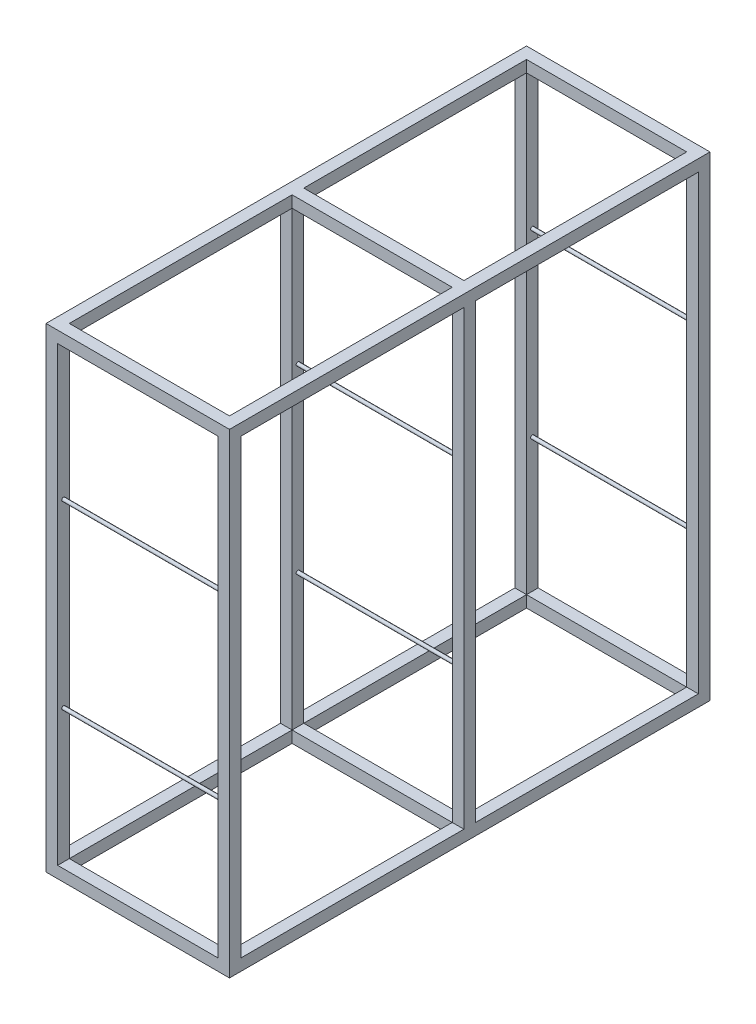
from build123d import *

# Parameters (mm, degrees)
SKETCH1_W             = 40
SKETCH1_H             = 40
SKETCH1_W_2           = 36
SKETCH1_H_2           = 36
BOSS_EXTRUDE1_DEPTH   = 825
BOSS_EXTRUDE1_2_DEPTH = 825
SKETCH2_W             = 40
SKETCH2_H             = 40
SKETCH2_W_2           = 36
SKETCH2_H_2           = 36
BOSS_EXTRUDE2_DEPTH   = 550
SKETCH3_W             = 40
SKETCH3_H             = 40
SKETCH3_W_2           = 36
SKETCH3_H_2           = 36
BOSS_EXTRUDE5_DEPTH   = 1551.5
SKETCH5_W             = 40
SKETCH5_H             = 40
SKETCH5_W_2           = 38
SKETCH5_H_2           = 38
BOSS_EXTRUDE6_DEPTH   = 1650
SKETCH6_W             = 40
SKETCH6_H             = 40
SKETCH6_W_2           = 38
SKETCH6_H_2           = 38
BOSS_EXTRUDE7_DEPTH   = 550
SKETCH7_R             = 6
BOSS_EXTRUDE8_DEPTH   = 550
SKETCH8_W             = 40
SKETCH8_H             = 40
BOSS_EXTRUDE10_DEPTH  = 1
SKETCH9_W             = 40
SKETCH9_H             = 40
BOSS_EXTRUDE11_DEPTH  = 1


with BuildPart() as part:
    # Sketch1 → Boss-Extrude1 (new, symmetric)
    with BuildSketch(Plane.XY):
        with Locations((-295, 20)):
            Rectangle(SKETCH1_W, SKETCH1_H)
        with Locations((-295, 20)):
            Rectangle(SKETCH1_W_2, SKETCH1_H_2, mode=Mode.SUBTRACT)
    extrude(amount=BOSS_EXTRUDE1_DEPTH, both=True)



with BuildPart() as body_2:
    # Sketch1 → Boss-Extrude1 2 (new, symmetric)
    with BuildSketch(Plane.XY):
        with Locations((295, 20)):
            Rectangle(SKETCH1_W, SKETCH1_H)
        with Locations((295, 20)):
            Rectangle(SKETCH1_W_2, SKETCH1_H_2, mode=Mode.SUBTRACT)
    extrude(amount=BOSS_EXTRUDE1_2_DEPTH, both=True)


with BuildPart() as part_1:
    add(part.part)

    add(body_2.part)  # Boss-Extrude2 merges body 2
    # Sketch2 → Boss-Extrude2 (add)
    # profile 1 of 3: a face of its own
    with BuildSketch(Plane(origin=(-275, 0, 0), x_dir=(0, 0, -1), z_dir=(1, 0, 0))):
        with Locations((-805, 20)):
            Rectangle(SKETCH2_W, SKETCH2_H)
        with Locations((-805, 20)):
            Rectangle(SKETCH2_W_2, SKETCH2_H_2, mode=Mode.SUBTRACT)
    # profile 2 of 3: a face of its own
    with BuildSketch(Plane(origin=(-275, 0, 0), x_dir=(0, 0, -1), z_dir=(1, 0, 0))):
        with Locations((805, 20)):
            Rectangle(SKETCH2_W, SKETCH2_H)
        with Locations((805, 20)):
            Rectangle(SKETCH2_W_2, SKETCH2_H_2, mode=Mode.SUBTRACT)
    # profile 3 of 3: a face of its own
    with BuildSketch(Plane(origin=(-275, 0, 0), x_dir=(0, 0, -1), z_dir=(1, 0, 0))):
        with Locations((0, 20)):
            Rectangle(SKETCH2_W, SKETCH2_H)
        with Locations((0, 20)):
            Rectangle(SKETCH2_W_2, SKETCH2_H_2, mode=Mode.SUBTRACT)
    extrude(amount=BOSS_EXTRUDE2_DEPTH)

    # Sketch3 → Boss-Extrude5 (add)
    # profile 1 of 6: a face of its own
    with BuildSketch(Plane(origin=(0, 40, 0), x_dir=(1, 0, 0), z_dir=(0, 1, 0))):
        with Locations((-295, -805)):
            Rectangle(SKETCH3_W, SKETCH3_H)
        with Locations((-295, -805)):
            Rectangle(SKETCH3_W_2, SKETCH3_H_2, mode=Mode.SUBTRACT)
    # profile 2 of 6: a face of its own
    with BuildSketch(Plane(origin=(0, 40, 0), x_dir=(1, 0, 0), z_dir=(0, 1, 0))):
        with Locations((295, -805)):
            Rectangle(SKETCH3_W, SKETCH3_H)
        with Locations((295, -805)):
            Rectangle(SKETCH3_W_2, SKETCH3_H_2, mode=Mode.SUBTRACT)
    # profile 3 of 6: a face of its own
    with BuildSketch(Plane(origin=(0, 40, 0), x_dir=(1, 0, 0), z_dir=(0, 1, 0))):
        with Locations((295, 0)):
            Rectangle(SKETCH3_W, SKETCH3_H)
        with Locations((295, 0)):
            Rectangle(SKETCH3_W_2, SKETCH3_H_2, mode=Mode.SUBTRACT)
    # profile 4 of 6: a face of its own
    with BuildSketch(Plane(origin=(0, 40, 0), x_dir=(1, 0, 0), z_dir=(0, 1, 0))):
        with Locations((-295, 0)):
            Rectangle(SKETCH3_W, SKETCH3_H)
        with Locations((-295, 0)):
            Rectangle(SKETCH3_W_2, SKETCH3_H_2, mode=Mode.SUBTRACT)
    # profile 5 of 6: a face of its own
    with BuildSketch(Plane(origin=(0, 40, 0), x_dir=(1, 0, 0), z_dir=(0, 1, 0))):
        with Locations((-295, 805)):
            Rectangle(SKETCH3_W, SKETCH3_H)
        with Locations((-295, 805)):
            Rectangle(SKETCH3_W_2, SKETCH3_H_2, mode=Mode.SUBTRACT)
    # profile 6 of 6: a face of its own
    with BuildSketch(Plane(origin=(0, 40, 0), x_dir=(1, 0, 0), z_dir=(0, 1, 0))):
        with Locations((295, 805)):
            Rectangle(SKETCH3_W, SKETCH3_H)
        with Locations((295, 805)):
            Rectangle(SKETCH3_W_2, SKETCH3_H_2, mode=Mode.SUBTRACT)
    extrude(amount=BOSS_EXTRUDE5_DEPTH)

    # Sketch5 → Boss-Extrude6 (add)
    # profile 1 of 2: a face of its own
    with BuildSketch(Plane.XY.offset(825)):
        with Locations((-295, 1611.5)):
            Rectangle(SKETCH5_W, SKETCH5_H)
        with Locations((-295, 1611.5)):
            Rectangle(SKETCH5_W_2, SKETCH5_H_2, mode=Mode.SUBTRACT)
    # profile 2 of 2: a face of its own
    with BuildSketch(Plane.XY.offset(825)):
        with Locations((295, 1611.5)):
            Rectangle(SKETCH5_W, SKETCH5_H)
        with Locations((295, 1611.5)):
            Rectangle(SKETCH5_W_2, SKETCH5_H_2, mode=Mode.SUBTRACT)
    extrude(amount=-BOSS_EXTRUDE6_DEPTH)

    # Sketch6 → Boss-Extrude7 (add)
    # profile 1 of 3: a face of its own
    with BuildSketch(Plane(origin=(-275, 0, 0), x_dir=(0, 0, -1), z_dir=(1, 0, 0))):
        with Locations((0, 1611.5)):
            Rectangle(SKETCH6_W, SKETCH6_H)
        with Locations((0, 1611.5)):
            Rectangle(SKETCH6_W_2, SKETCH6_H_2, mode=Mode.SUBTRACT)
    # profile 2 of 3: a face of its own
    with BuildSketch(Plane(origin=(-275, 0, 0), x_dir=(0, 0, -1), z_dir=(1, 0, 0))):
        with Locations((-805, 1611.5)):
            Rectangle(SKETCH6_W, SKETCH6_H)
        with Locations((-805, 1611.5)):
            Rectangle(SKETCH6_W_2, SKETCH6_H_2, mode=Mode.SUBTRACT)
    # profile 3 of 3: a face of its own
    with BuildSketch(Plane(origin=(-275, 0, 0), x_dir=(0, 0, -1), z_dir=(1, 0, 0))):
        with Locations((805, 1611.5)):
            Rectangle(SKETCH6_W, SKETCH6_H)
        with Locations((805, 1611.5)):
            Rectangle(SKETCH6_W_2, SKETCH6_H_2, mode=Mode.SUBTRACT)
    extrude(amount=BOSS_EXTRUDE7_DEPTH)

    # Sketch7 → Boss-Extrude8 (add)
    with BuildSketch(Plane.ZY.offset(-275)):
        with Locations(Location((805, 1119, 0), (0, 0, 180))):
            Circle(SKETCH7_R)
        with Locations(Location((805, 499, 0), (0, 0, 180))):
            Circle(SKETCH7_R)
        with Locations(Location((0, 1119, 0), (0, 0, 180))):
            Circle(SKETCH7_R)
        with Locations(Location((0, 499, 0), (0, 0, 180))):
            Circle(SKETCH7_R)
        with Locations(Location((-805, 499, 0), (0, 0, 180))):
            Circle(SKETCH7_R)
        with Locations(Location((-805, 1119, 0), (0, 0, 180))):
            Circle(SKETCH7_R)
    extrude(amount=BOSS_EXTRUDE8_DEPTH)

    # Sketch8 → Boss-Extrude10 (add)
    with BuildSketch(Plane.XY.offset(825)):
        with Locations((-295, 1611.5)):
            Rectangle(SKETCH8_W, SKETCH8_H)
        with Locations((295, 1611.5)):
            Rectangle(SKETCH8_W, SKETCH8_H)
        with Locations((-295, 20)):
            Rectangle(SKETCH8_W, SKETCH8_H)
        with Locations((295, 20)):
            Rectangle(SKETCH8_W, SKETCH8_H)
    extrude(amount=-BOSS_EXTRUDE10_DEPTH)

    # Sketch9 → Boss-Extrude11 (add)
    with BuildSketch(Plane(origin=(0, 0, -825), x_dir=(-1, 0, 0), z_dir=(0, 0, -1))):
        with Locations((-295, 1611.5)):
            Rectangle(SKETCH9_W, SKETCH9_H)
        with Locations((295, 1611.5)):
            Rectangle(SKETCH9_W, SKETCH9_H)
        with Locations((295, 20)):
            Rectangle(SKETCH9_W, SKETCH9_H)
        with Locations((-295, 20)):
            Rectangle(SKETCH9_W, SKETCH9_H)
    extrude(amount=-BOSS_EXTRUDE11_DEPTH)


solid = part_1.part
